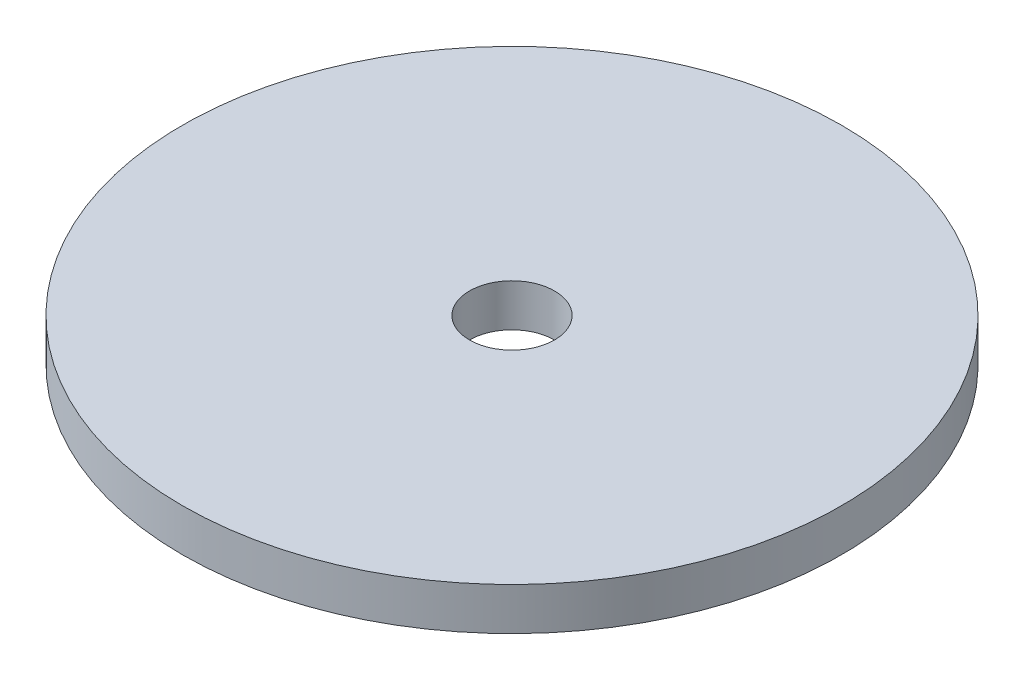
from build123d import *

# Parameters (mm, degrees)
SKETCH1_R           = 196.85
SKETCH1_R_2         = 25.4
BOSS_EXTRUDE1_DEPTH = 25.4


with BuildPart() as part:
    # Sketch1 → Boss-Extrude1 (new body)
    with BuildSketch(Plane(origin=(0, 0, 0), x_dir=(1, 0, 0), z_dir=(0, 1, 0))):
        Circle(SKETCH1_R)
        Circle(SKETCH1_R_2, mode=Mode.SUBTRACT)
    extrude(amount=BOSS_EXTRUDE1_DEPTH)


solid = part.part
